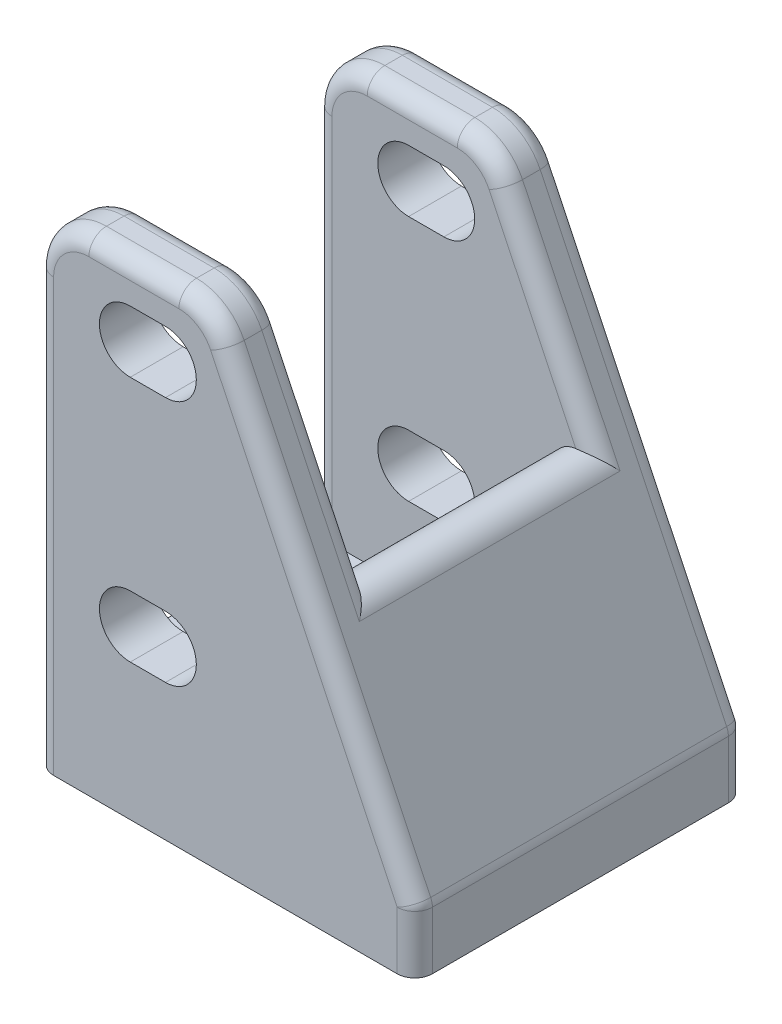
from build123d import *

# Parameters (mm, degrees)
SKETCH1_W           = 43
SKETCH1_H           = 25.6
SKETCH1_R           = 3.2305
BOSS_EXTRUDE1_DEPTH = 7
BOSS_EXTRUDE2_DEPTH = 6
FILLET1_R           = 6
BOSS_EXTRUDE3_REACH = 57.854
SKETCH3_W           = 16
SKETCH3_H           = 25.6
FILLET2_R           = 3
FILLET3_R           = 2


with BuildPart() as part:
    # Sketch1 → Boss-Extrude1 (new body)
    with BuildSketch(Plane(origin=(0, 0, 0), x_dir=(1, 0, 0), z_dir=(0, 1, 0))):
        Rectangle(SKETCH1_W, SKETCH1_H)
        with Locations(Location((-8.8, 0, 0), (0, 0, 270))):
            Circle(SKETCH1_R, mode=Mode.SUBTRACT)
        with Locations(Location((11.2, 0, 0), (0, 0, 270))):
            Circle(SKETCH1_R, mode=Mode.SUBTRACT)
    extrude(amount=BOSS_EXTRUDE1_DEPTH)

    # Sketch2 → Boss-Extrude2 (add)
    with BuildSketch(Plane.XY.offset(12.8)):
        Polygon((21.5, 7), (21.5, 0), (-21.5, 0), (-21.5, 7), (-21.5, 55), (-1.5, 55), align=None)
        with BuildLine():
            Line((-10.8, 50.5), (-6.8, 50.5))
            ThreePointArc((-6.8, 50.5), (-3.3, 47), (-6.8, 43.5))
            Line((-6.8, 43.5), (-10.8, 43.5))
            ThreePointArc((-10.8, 43.5), (-14.3, 47), (-10.8, 50.5))
        make_face(mode=Mode.SUBTRACT)
        with BuildLine():
            Line((-10.8, 22.5), (-6.8, 22.5))
            ThreePointArc((-6.8, 22.5), (-3.3, 19), (-6.8, 15.5))
            Line((-6.8, 15.5), (-10.8, 15.5))
            ThreePointArc((-10.8, 15.5), (-14.3, 19), (-10.8, 22.5))
        make_face(mode=Mode.SUBTRACT)
    boss_extrude2 = extrude(amount=BOSS_EXTRUDE2_DEPTH)

    # Mirror1: Boss-Extrude2 across plane
    add(boss_extrude2.mirror(Plane.XY))

    # Fillet1
    fillet1_edges = [part.edges().sort_by_distance(p)[0] for p in [
        (-1.5, 55, 15.8),
        (-21.5, 55, 15.8),
        (-1.5, 55, -15.8),
        (-21.5, 55, -15.8),
    ]]
    fillet(fillet1_edges, radius=FILLET1_R)

    # Boss-Extrude3: up to this face of the body (flat: up to its plane)
    boss_extrude3_end = Plane(part.part.faces().sort_by_distance((10.816327241, 29.296360541, -15.8))[0])
    # Sketch3 → Boss-Extrude3 (add, up to the picked face)
    with BuildSketch(Plane(origin=(0, 7, 0), x_dir=(1, 0, 0), z_dir=(0, 1, 0)), mode=Mode.PRIVATE) as boss_extrude3_sk1:
        with Locations((13.5, 0)):
            Rectangle(SKETCH3_W, SKETCH3_H)
    boss_extrude3_tool1 = split(extrude(boss_extrude3_sk1.sketch, amount=BOSS_EXTRUDE3_REACH, mode=Mode.PRIVATE), bisect_by=boss_extrude3_end, keep=Keep.BOTH, mode=Mode.PRIVATE)
    add(boss_extrude3_tool1.solids().sort_by(Axis((13.5, 7, 0), (0, 1, 0)))[0])

    # Fillet2
    fillet2_edges = [part.edges().sort_by_distance(p)[0] for p in [
        (5.5, 40.391304348, 0),
    ]]
    fillet(fillet2_edges, radius=FILLET2_R)

    # Fillet3
    fillet3_edges = [part.edges().sort_by_distance(p)[0] for p in [
        (-2.081080958, 54.077220031, 18.8),
        (-19.742640687, 53.242640687, 18.8),
        (5.669051284, 40.038501669, -12.8),
        (5.669051284, 40.038501669, 12.8),
        (10.816327241, 29.296360541, 18.8),
        (21.5, 3.5, 18.8),
        (21.5, 7, 0),
        (10.816327241, 29.296360541, -18.8),
        (21.5, 3.5, -18.8),
        (-10.389120846, 55, -12.8),
        (-10.389120846, 55, -18.8),
        (-21.5, 28, -12.8),
        (-2.081080958, 54.077220031, -12.8),
        (-19.742640687, 53.242640687, -12.8),
        (-21.5, 24.5, 18.8),
        (-21.5, 28, 12.8),
        (-21.5, 24.5, -18.8),
        (-2.081080958, 54.077220031, -18.8),
        (-19.742640687, 53.242640687, -18.8),
        (-10.389120846, 55, 12.8),
        (-2.081080958, 54.077220031, 12.8),
        (-19.742640687, 53.242640687, 12.8),
        (-10.389120846, 55, 18.8),
    ]]
    fillet(fillet3_edges, radius=FILLET3_R)


solid = part.part
